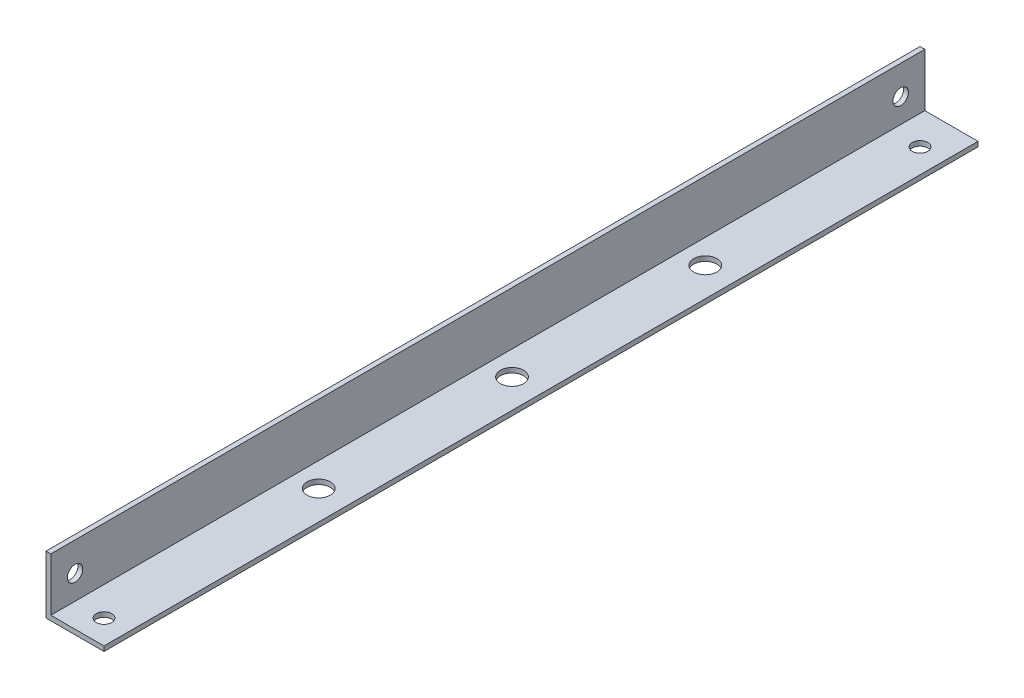
from build123d import *

# Parameters (mm, degrees)
BOSS_EXTRUDE1_DEPTH = 226.1
SKETCH2_R           = 4
SKETCH2_R_2         = 6
CUT_EXTRUDE1_DEPTH  = 230.733454246
SKETCH3_R           = 4
CUT_EXTRUDE2_DEPTH  = 230.733454246


with BuildPart() as part:
    # Sketch1 → Boss-Extrude1 (new, symmetric)
    with BuildSketch(Plane.XY):
        Polygon((0, 2.5), (0, 30), (2.5, 30), (2.5, 2.5), (30, 2.5), (30, 0), (0, 0), align=None)
    extrude(amount=BOSS_EXTRUDE1_DEPTH, both=True)

    # Sketch2 → Cut-Extrude1 (cut, through all)
    with BuildSketch(Plane(origin=(0, 2.5, 0), x_dir=(1, 0, 0), z_dir=(0, 1, 0))):
        with Locations(Location((17.5, 208.6, 0), (0, 0, 180))):
            Circle(SKETCH2_R)
        with Locations(Location((17.5, -213.6, 0), (0, 0, 180))):
            Circle(SKETCH2_R)
        with Locations(Location((15, -100, 0), (0, 0, 180))):
            Circle(SKETCH2_R_2)
        with Locations(Location((15, 100, 0), (0, 0, 180))):
            Circle(SKETCH2_R_2)
        with Locations(Location((15, 0, 0), (0, 0, 180))):
            Circle(SKETCH2_R_2)
    extrude(amount=-CUT_EXTRUDE1_DEPTH, mode=Mode.SUBTRACT)

    # Sketch3 → Cut-Extrude2 (cut, through all)
    with BuildSketch(Plane(origin=(2.5, 0, 0), x_dir=(0, 0, -1), z_dir=(1, 0, 0))):
        with Locations((-213.6, 15)):
            Circle(SKETCH3_R)
        with Locations(Location((213.6, 15, 0), (0, 0, 180))):
            Circle(SKETCH3_R)
    extrude(amount=-CUT_EXTRUDE2_DEPTH, mode=Mode.SUBTRACT)


solid = part.part
